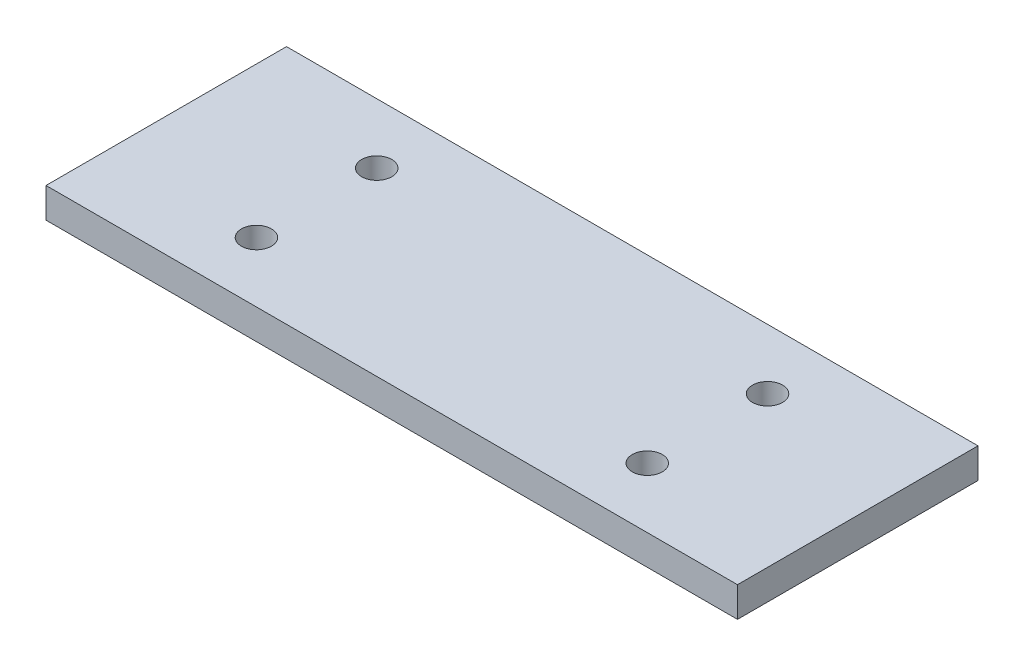
from build123d import *

# Parameters (mm, degrees)
SKETCH1_W           = 115
SKETCH1_H           = 40
SKETCH1_R           = 2.5
BOSS_EXTRUDE1_DEPTH = 2.5


with BuildPart() as part:
    # Sketch1 → Boss-Extrude1 (new, symmetric)
    with BuildSketch(Plane(origin=(0, 0, 0), x_dir=(1, 0, 0), z_dir=(0, 1, 0))):
        Rectangle(SKETCH1_W, SKETCH1_H)
        with Locations(Location((-32.5, 10, 0), (0, 0, 270))):
            Circle(SKETCH1_R, mode=Mode.SUBTRACT)
        with Locations(Location((32.5, 10, 0), (0, 0, 270))):
            Circle(SKETCH1_R, mode=Mode.SUBTRACT)
        with Locations(Location((-32.5, -10, 0), (0, 0, 270))):
            Circle(SKETCH1_R, mode=Mode.SUBTRACT)
        with Locations(Location((32.5, -10, 0), (0, 0, 270))):
            Circle(SKETCH1_R, mode=Mode.SUBTRACT)
    extrude(amount=BOSS_EXTRUDE1_DEPTH, both=True)


solid = part.part
